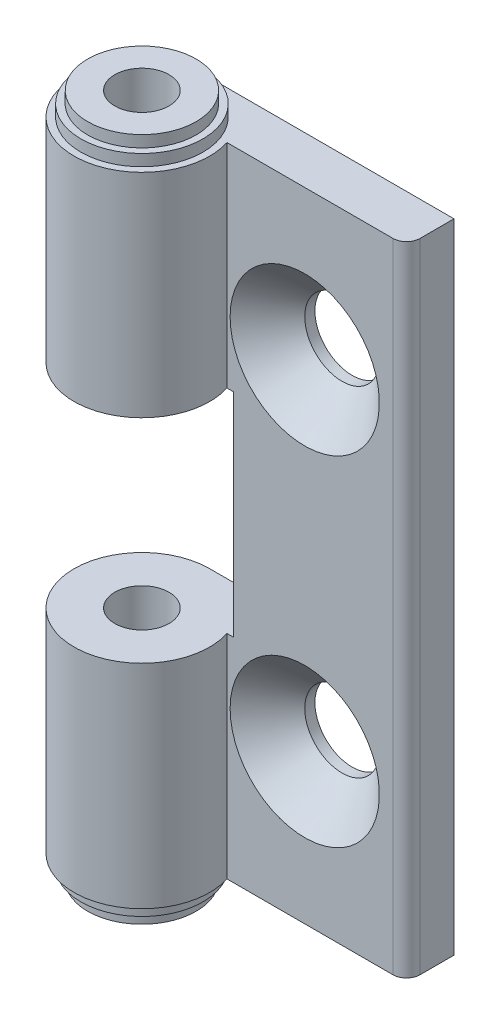
from build123d import *

# Parameters (mm, degrees)
SKETCH1_W               = 5
SKETCH1_H               = 47
SKETCH2_W               = 18
SKETCH2_H               = 47
BOSS_EXTRUDE1_DEPTH     = 3.5
CUT_EXTRUDE1_DEPTH      = 47
CUT_EXTRUDE1_DEPTH_BACK = 47
SKETCH3_W               = 94
SKETCH3_H               = 94
SKETCH6_W               = 2
SKETCH6_H               = 53.4
CUT_EXTRUDE2_DEPTH      = 23.5
CUT_EXTRUDE2_DEPTH_BACK = 23.5


with BuildPart() as part:
    # Sketch1 → Revolve1 (revolve)
    with BuildSketch(Plane.XY):
        with Locations((2.5, 0)):
            Rectangle(SKETCH1_W, SKETCH1_H)
    revolve(axis=Axis((0, -23.5, 0), (0, 1, 0)))

    # Sketch2 → Boss-Extrude1 (add)
    with BuildSketch(Plane.XY.offset(-5)):
        with Locations((9, 0)):
            Rectangle(SKETCH2_W, SKETCH2_H)
    extrude(amount=BOSS_EXTRUDE1_DEPTH)

    # Sketch3 → Cut-Extrude1 (cut, two sides: drawn at the far end of the back side and taken through both)
    with BuildSketch(Plane.XY.offset(-CUT_EXTRUDE1_DEPTH_BACK)):
        Rectangle(SKETCH3_W, SKETCH3_H)
        Polygon((-5, 7.833333333), (5.25, 7.833333333), (5.25, -7.833333333), (-5, -7.833333333), (-5, -23.5), (18, -23.5), (18, 23.5), (-5, 23.5), align=None, mode=Mode.SUBTRACT)
    extrude(amount=CUT_EXTRUDE1_DEPTH + CUT_EXTRUDE1_DEPTH_BACK, mode=Mode.SUBTRACT)

    # Sketch4 → Revolve2 (revolve)
    with BuildSketch(Plane.XY):
        Polygon((0, 25.2), (4, 25.2), (4, 24.35), (4.5, 24.35), (4.5, 23.5), (0, 23.5), align=None)
    revolve(axis=Axis((0, 23.5, 0), (0, 1, 0)))

    # Sketch5 → Revolve3 (revolve)
    with BuildSketch(Plane.XY):
        Polygon((0, -23.5), (4.5, -23.5), (4.5, -24.35), (4, -24.35), (4, -25.2), (0, -25.2), align=None)
    revolve(axis=Axis((0, -25.2, 0), (0, 1, 0)))

    # Sketch6 → Cut-Revolve1 (revolve, cut)
    with BuildSketch(Plane.XY):
        with Locations((1, 0)):
            Rectangle(SKETCH6_W, SKETCH6_H)
    revolve(axis=Axis((0, -26.7, 0), (0, 1, 0)), mode=Mode.SUBTRACT)

    # Sketch7 → Cut-Revolve2 (revolve, cut)
    with BuildSketch(Plane(origin=(10.5, 0, 0), x_dir=(0, 0, -1), z_dir=(1, 0, 0))):
        Polygon((5, -12.5), (5, -15.25), (4.25, -15.25), (1.5, -18), (1.5, -12.5), align=None)
    revolve(axis=Axis((10.5, -12.5, -1.5), (0, 0, -1)), mode=Mode.SUBTRACT)

    # Sketch8 → Cut-Revolve3 (revolve, cut)
    with BuildSketch(Plane(origin=(10.5, 0, 0), x_dir=(0, 0, -1), z_dir=(1, 0, 0))):
        Polygon((5, 12.5), (5, 9.75), (4.25, 9.75), (1.5, 7), (1.5, 12.5), align=None)
    revolve(axis=Axis((10.5, 12.5, -1.5), (0, 0, -1)), mode=Mode.SUBTRACT)

    # Sketch9 → Cut-Extrude2 (cut, two sides: drawn at the far end of the back side and taken through both)
    with BuildSketch(Plane(origin=(0, 0, 0), x_dir=(1, 0, 0), z_dir=(0, 1, 0)).offset(-CUT_EXTRUDE2_DEPTH_BACK)):
        with BuildLine():
            Line((17, 1.5), (18, 1.5))
            Line((18, 1.5), (18, 2.5))
            ThreePointArc((18, 2.5), (17.707106781, 1.792893219), (17, 1.5))
        make_face()
    extrude(amount=CUT_EXTRUDE2_DEPTH + CUT_EXTRUDE2_DEPTH_BACK, mode=Mode.SUBTRACT)


solid = part.part
